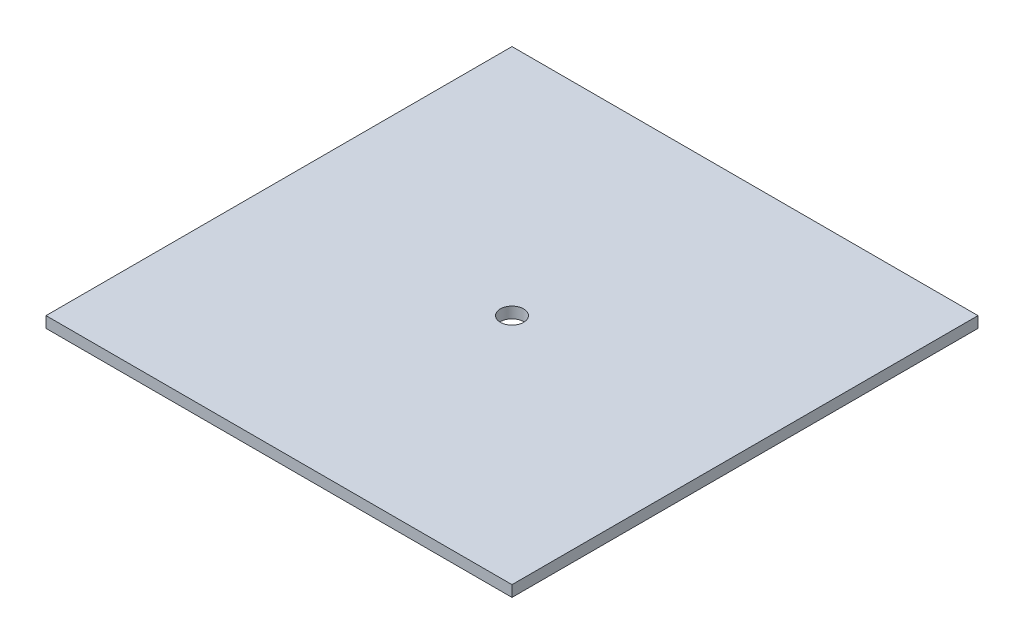
from build123d import *

# Parameters (mm, degrees)
SKETCH1_W           = 200
SKETCH1_H           = 200
SKETCH1_R           = 5
BOSS_EXTRUDE1_DEPTH = 4.7625


with BuildPart() as part:
    # Sketch1 → Boss-Extrude1 (new body)
    with BuildSketch(Plane(origin=(0, 0, 0), x_dir=(1, 0, 0), z_dir=(0, 1, 0))):
        with Locations((-100, 100)):
            Rectangle(SKETCH1_W, SKETCH1_H)
        with Locations(Location((-100, 100, 0), (0, 0, 90))):
            Circle(SKETCH1_R, mode=Mode.SUBTRACT)
    extrude(amount=BOSS_EXTRUDE1_DEPTH)


solid = part.part
